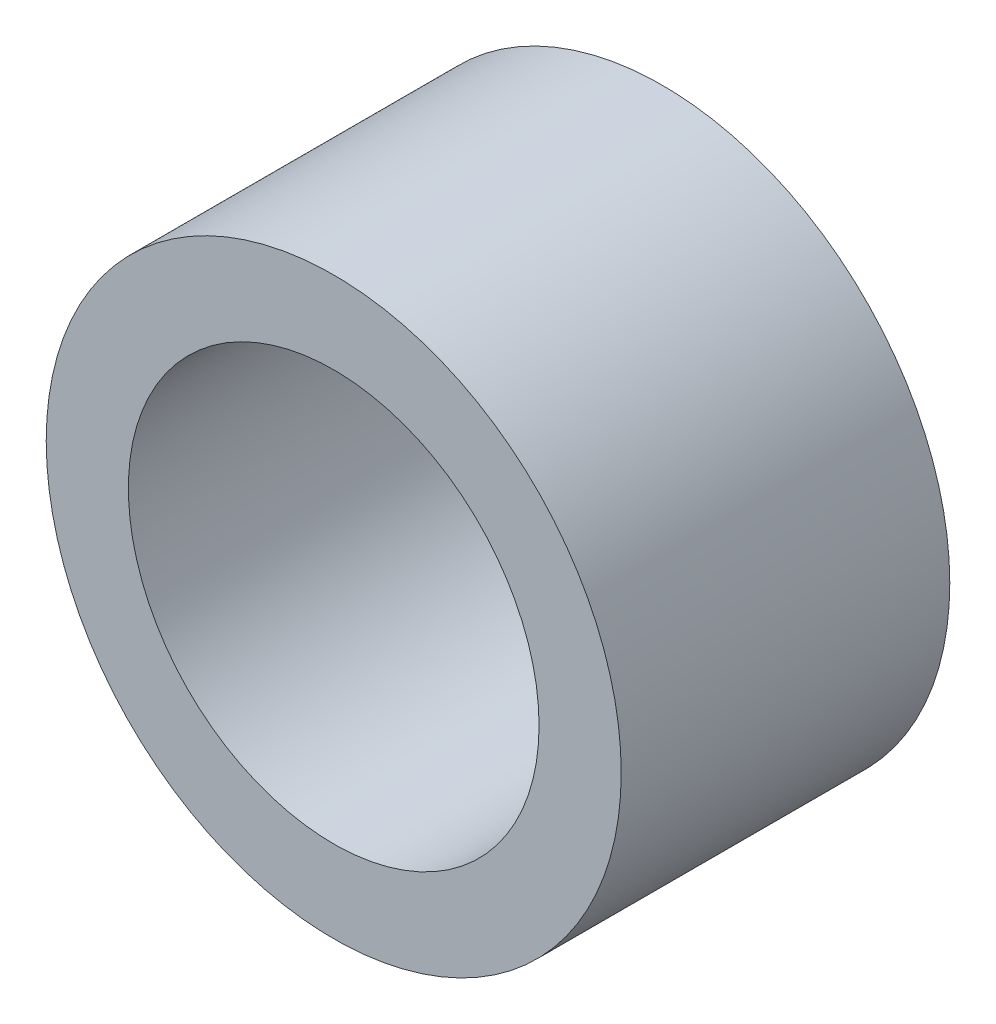
from build123d import *

# Parameters (mm, degrees)
BOSS_EXTRUDE1_START = 25.4
SKETCH1_R           = 44.45
SKETCH1_R_2         = 31.75
BOSS_EXTRUDE1_DEPTH = 50.8


with BuildPart() as part:
    # Sketch1 → Boss-Extrude1 (new body)
    with BuildSketch(Plane.XY.offset(BOSS_EXTRUDE1_START)):
        Circle(SKETCH1_R)
        Circle(SKETCH1_R_2, mode=Mode.SUBTRACT)
    extrude(amount=-BOSS_EXTRUDE1_DEPTH)


solid = part.part
